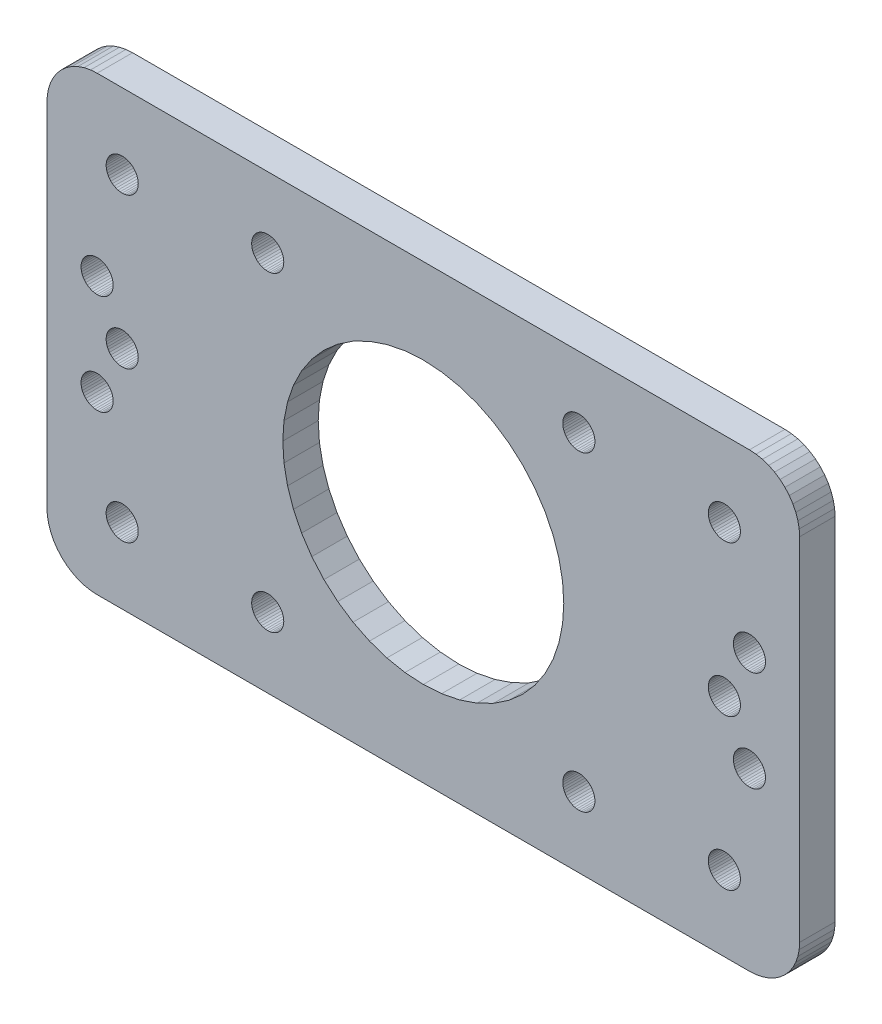
from build123d import *

# Parameters (mm, degrees)
BOSS_EXTRUDE1_DEPTH = 3.532000065


with BuildPart() as part:
    # Sketch1 → Boss-Extrude1 (new body)
    with BuildSketch(Plane.XY.offset(3.532000065)):
        Polygon((70, 0), (70.652633667, 0.042775694), (71.2940979, 0.170370862), (71.913414001, 0.38060233), (72.5, 0.669872999), (73.043807983, 1.033233285), (73.53553772, 1.464466095), (73.966766357, 1.956192851), (74.330123901, 2.5), (74.619400024, 3.086582899), (74.829627991, 3.705904722), (74.957221985, 4.347369194), (75, 5), (75, 40), (74.957221985, 40.652629852), (74.829627991, 41.294094086), (74.619400024, 41.913417816), (74.330123901, 42.5), (73.966766357, 43.043807983), (73.53553772, 43.535533905), (73.043807983, 43.966766357), (72.5, 44.330127716), (71.913414001, 44.61939621), (71.2940979, 44.829627991), (70.652633667, 44.9572258), (70, 45), (5, 45), (4.347369194, 44.9572258), (3.705904722, 44.829627991), (3.086582899, 44.61939621), (2.5, 44.330127716), (1.956192851, 43.966766357), (1.464466095, 43.535533905), (1.033233285, 43.043807983), (0.669872999, 42.5), (0.38060233, 41.913417816), (0.170370862, 41.294094086), (0.042775694, 40.652629852), (0, 40), (0, 5), (0.042775694, 4.347369194), (0.170370862, 3.705904722), (0.38060233, 3.086582899), (0.669872999, 2.5), (1.033233285, 1.956192851), (1.464466095, 1.464466095), (1.956192851, 1.033233285), (2.5, 0.669872999), (3.086582899, 0.38060233), (3.705904722, 0.170370862), (4.347369194, 0.042775694), (5, 0), align=None)
        Polygon((5.954518795, 22.085889816), (5.913688183, 22.291158676), (5.900000095, 22.5), (5.913688183, 22.708841324), (5.954518795, 22.914110184), (6.021792889, 23.112293243), (6.114359379, 23.299999237), (6.230634689, 23.474018097), (6.368628979, 23.631370544), (6.525981903, 23.769365311), (6.699999809, 23.885641098), (6.88770628, 23.978206635), (7.085889339, 24.045480728), (7.291158199, 24.08631134), (7.5, 24.100000381), (7.708841801, 24.08631134), (7.914110661, 24.045480728), (8.112293243, 23.978206635), (8.300000191, 23.885641098), (8.474018097, 23.769365311), (8.631370544, 23.631370544), (8.769365311, 23.474018097), (8.885641098, 23.299999237), (8.978207588, 23.112293243), (9.045481682, 22.914110184), (9.08631134, 22.708841324), (9.100000381, 22.5), (9.08631134, 22.291158676), (9.045481682, 22.085889816), (8.978207588, 21.887706757), (8.885641098, 21.700000763), (8.769365311, 21.525981903), (8.631370544, 21.368629456), (8.474018097, 21.230634689), (8.300000191, 21.114358902), (8.112293243, 21.021793365), (7.914110661, 20.954519272), (7.708841801, 20.91368866), (7.5, 20.899999619), (7.291158199, 20.91368866), (7.085889339, 20.954519272), (6.88770628, 21.021793365), (6.699999809, 21.114358902), (6.525981903, 21.230634689), (6.368628979, 21.368629456), (6.230634689, 21.525981903), (6.114359379, 21.700000763), (6.021792889, 21.887706757), align=None, mode=Mode.SUBTRACT)
        Polygon((5.61229372, 18.978206635), (5.800000191, 18.885641098), (5.974018097, 18.769365311), (6.131371021, 18.631370544), (6.269365311, 18.474018097), (6.385640621, 18.299999237), (6.478207111, 18.112293243), (6.545481205, 17.914110184), (6.586311817, 17.708841324), (6.599999905, 17.5), (6.586311817, 17.291158676), (6.545481205, 17.085889816), (6.478207111, 16.887706757), (6.385640621, 16.700000763), (6.269365311, 16.525981903), (6.131371021, 16.368629456), (5.974018097, 16.230634689), (5.800000191, 16.114358902), (5.61229372, 16.021793365), (5.414110661, 15.954518318), (5.208841801, 15.91368866), (5, 15.899999619), (4.791158199, 15.91368866), (4.585889339, 15.954518318), (4.38770628, 16.021793365), (4.199999809, 16.114358902), (4.025981903, 16.230634689), (3.868629217, 16.368629456), (3.730634689, 16.525981903), (3.614359379, 16.700000763), (3.52179265, 16.887706757), (3.454518795, 17.085889816), (3.413688183, 17.291158676), (3.400000095, 17.5), (3.413688183, 17.708841324), (3.454518795, 17.914110184), (3.52179265, 18.112293243), (3.614359379, 18.299999237), (3.730634689, 18.474018097), (3.868629217, 18.631370544), (4.025981903, 18.769365311), (4.199999809, 18.885641098), (4.38770628, 18.978206635), (4.585889339, 19.045480728), (4.791158199, 19.08631134), (5, 19.100000381), (5.208841801, 19.08631134), (5.414110661, 19.045480728), align=None, mode=Mode.SUBTRACT)
        Polygon((69.387702942, 18.978206635), (69.585891724, 19.045480728), (69.791160583, 19.08631134), (70, 19.100000381), (70.208839417, 19.08631134), (70.414108276, 19.045480728), (70.612297058, 18.978206635), (70.800003052, 18.885641098), (70.974021912, 18.769365311), (71.131370544, 18.631370544), (71.269363403, 18.474018097), (71.385643005, 18.299999237), (71.478210449, 18.112293243), (71.545478821, 17.914110184), (71.58631134, 17.708841324), (71.599998474, 17.5), (71.58631134, 17.291158676), (71.545478821, 17.085889816), (71.478210449, 16.887706757), (71.385643005, 16.700000763), (71.269363403, 16.525981903), (71.131370544, 16.368629456), (70.974021912, 16.230634689), (70.800003052, 16.114358902), (70.612297058, 16.021793365), (70.414108276, 15.954518318), (70.208839417, 15.91368866), (70, 15.899999619), (69.791160583, 15.91368866), (69.585891724, 15.954518318), (69.387702942, 16.021793365), (69.199996948, 16.114358902), (69.025978088, 16.230634689), (68.868629456, 16.368629456), (68.730636597, 16.525981903), (68.614356995, 16.700000763), (68.521789551, 16.887706757), (68.454521179, 17.085889816), (68.41368866, 17.291158676), (68.400001526, 17.5), (68.41368866, 17.708841324), (68.454521179, 17.914110184), (68.521789551, 18.112293243), (68.614356995, 18.299999237), (68.730636597, 18.474018097), (68.868629456, 18.631370544), (69.025978088, 18.769365311), (69.199996948, 18.885641098), align=None, mode=Mode.SUBTRACT)
        Polygon((69.08631134, 22.708841324), (69.099998474, 22.5), (69.08631134, 22.291158676), (69.045478821, 22.085889816), (68.978210449, 21.887706757), (68.885643005, 21.700000763), (68.769363403, 21.525981903), (68.631370544, 21.368629456), (68.474021912, 21.230634689), (68.300003052, 21.114358902), (68.112297058, 21.021793365), (67.914108276, 20.954519272), (67.708839417, 20.91368866), (67.5, 20.899999619), (67.291160583, 20.91368866), (67.085891724, 20.954519272), (66.887702942, 21.021793365), (66.699996948, 21.114358902), (66.525978088, 21.230634689), (66.368629456, 21.368629456), (66.230636597, 21.525981903), (66.114356995, 21.700000763), (66.021789551, 21.887706757), (65.954521179, 22.085889816), (65.91368866, 22.291158676), (65.900001526, 22.5), (65.91368866, 22.708841324), (65.954521179, 22.914110184), (66.021789551, 23.112293243), (66.114356995, 23.299999237), (66.230636597, 23.474018097), (66.368629456, 23.631370544), (66.525978088, 23.769365311), (66.699996948, 23.885641098), (66.887702942, 23.978206635), (67.085891724, 24.045480728), (67.291160583, 24.08631134), (67.5, 24.100000381), (67.708839417, 24.08631134), (67.914108276, 24.045480728), (68.112297058, 23.978206635), (68.300003052, 23.885641098), (68.474021912, 23.769365311), (68.631370544, 23.631370544), (68.769363403, 23.474018097), (68.885643005, 23.299999237), (68.978210449, 23.112293243), (69.045478821, 22.914110184), align=None, mode=Mode.SUBTRACT)
        Polygon((6.368628979, 8.631370544), (6.525981903, 8.769365311), (6.699999809, 8.885641098), (6.88770628, 8.978207588), (7.085889339, 9.045481682), (7.291158199, 9.08631134), (7.5, 9.100000381), (7.708841801, 9.08631134), (7.914110661, 9.045481682), (8.112293243, 8.978207588), (8.300000191, 8.885641098), (8.474018097, 8.769365311), (8.631370544, 8.631370544), (8.769365311, 8.474018097), (8.885641098, 8.300000191), (8.978207588, 8.112293243), (9.045481682, 7.914110661), (9.08631134, 7.708841801), (9.100000381, 7.5), (9.08631134, 7.291158199), (9.045481682, 7.085889339), (8.978207588, 6.88770628), (8.885641098, 6.699999809), (8.769365311, 6.525981903), (8.631370544, 6.368628979), (8.474018097, 6.230634689), (8.300000191, 6.114359379), (8.112293243, 6.021792889), (7.914110661, 5.954518795), (7.708841801, 5.913688183), (7.5, 5.900000095), (7.291158199, 5.913688183), (7.085889339, 5.954518795), (6.88770628, 6.021792889), (6.699999809, 6.114359379), (6.525981903, 6.230634689), (6.368628979, 6.368628979), (6.230634689, 6.525981903), (6.114359379, 6.699999809), (6.021792889, 6.88770628), (5.954518795, 7.085889339), (5.913688183, 7.291158199), (5.900000095, 7.5), (5.913688183, 7.708841801), (5.954518795, 7.914110661), (6.021792889, 8.112293243), (6.114359379, 8.300000191), (6.230634689, 8.474018097), align=None, mode=Mode.SUBTRACT)
        Polygon((68.300003052, 8.885641098), (68.474021912, 8.769365311), (68.631370544, 8.631370544), (68.769363403, 8.474018097), (68.885643005, 8.300000191), (68.978210449, 8.112293243), (69.045478821, 7.914110661), (69.08631134, 7.708841801), (69.099998474, 7.5), (69.08631134, 7.291158199), (69.045478821, 7.085889339), (68.978210449, 6.88770628), (68.885643005, 6.699999809), (68.769363403, 6.525981903), (68.631370544, 6.368628979), (68.474021912, 6.230634689), (68.300003052, 6.114359379), (68.112297058, 6.021792889), (67.914108276, 5.954518795), (67.708839417, 5.913688183), (67.5, 5.900000095), (67.291160583, 5.913688183), (67.085891724, 5.954518795), (66.887702942, 6.021792889), (66.699996948, 6.114359379), (66.525978088, 6.230634689), (66.368629456, 6.368628979), (66.230636597, 6.525981903), (66.114356995, 6.699999809), (66.021789551, 6.88770628), (65.954521179, 7.085889339), (65.91368866, 7.291158199), (65.900001526, 7.5), (65.91368866, 7.708841801), (65.954521179, 7.914110661), (66.021789551, 8.112293243), (66.114356995, 8.300000191), (66.230636597, 8.474018097), (66.368629456, 8.631370544), (66.525978088, 8.769365311), (66.699996948, 8.885641098), (66.887702942, 8.978207588), (67.085891724, 9.045481682), (67.291160583, 9.08631134), (67.5, 9.100000381), (67.708839417, 9.08631134), (67.914108276, 9.045481682), (68.112297058, 8.978207588), align=None, mode=Mode.SUBTRACT)
        Polygon((6.586311817, 27.708841324), (6.599999905, 27.5), (6.586311817, 27.291158676), (6.545481205, 27.085889816), (6.478207111, 26.887706757), (6.385640621, 26.700000763), (6.269365311, 26.525981903), (6.131371021, 26.368629456), (5.974018097, 26.230634689), (5.800000191, 26.114358902), (5.61229372, 26.021793365), (5.414110661, 25.954519272), (5.208841801, 25.91368866), (5, 25.899999619), (4.791158199, 25.91368866), (4.585889339, 25.954519272), (4.38770628, 26.021793365), (4.199999809, 26.114358902), (4.025981903, 26.230634689), (3.868629217, 26.368629456), (3.730634689, 26.525981903), (3.614359379, 26.700000763), (3.52179265, 26.887706757), (3.454518795, 27.085889816), (3.413688183, 27.291158676), (3.400000095, 27.5), (3.413688183, 27.708841324), (3.454518795, 27.914110184), (3.52179265, 28.112293243), (3.614359379, 28.299999237), (3.730634689, 28.474018097), (3.868629217, 28.631370544), (4.025981903, 28.769365311), (4.199999809, 28.885641098), (4.38770628, 28.978206635), (4.585889339, 29.045480728), (4.791158199, 29.08631134), (5, 29.100000381), (5.208841801, 29.08631134), (5.414110661, 29.045480728), (5.61229372, 28.978206635), (5.800000191, 28.885641098), (5.974018097, 28.769365311), (6.131371021, 28.631370544), (6.269365311, 28.474018097), (6.385640621, 28.299999237), (6.478207111, 28.112293243), (6.545481205, 27.914110184), align=None, mode=Mode.SUBTRACT)
        Polygon((68.300003052, 36.114360809), (68.112297058, 36.021793365), (67.914108276, 35.954517365), (67.708839417, 35.91368866), (67.5, 35.900001526), (67.291160583, 35.91368866), (67.085891724, 35.954517365), (66.887702942, 36.021793365), (66.699996948, 36.114360809), (66.525978088, 36.230632782), (66.368629456, 36.368629456), (66.230636597, 36.525981903), (66.114356995, 36.700000763), (66.021789551, 36.887706757), (65.954521179, 37.085887909), (65.91368866, 37.291156769), (65.900001526, 37.5), (65.91368866, 37.708843231), (65.954521179, 37.914112091), (66.021789551, 38.112293243), (66.114356995, 38.299999237), (66.230636597, 38.474018097), (66.368629456, 38.631370544), (66.525978088, 38.769367218), (66.699996948, 38.885639191), (66.887702942, 38.978206635), (67.085891724, 39.045482635), (67.291160583, 39.08631134), (67.5, 39.099998474), (67.708839417, 39.08631134), (67.914108276, 39.045482635), (68.112297058, 38.978206635), (68.300003052, 38.885639191), (68.474021912, 38.769367218), (68.631370544, 38.631370544), (68.769363403, 38.474018097), (68.885643005, 38.299999237), (68.978210449, 38.112293243), (69.045478821, 37.914112091), (69.08631134, 37.708843231), (69.099998474, 37.5), (69.08631134, 37.291156769), (69.045478821, 37.085887909), (68.978210449, 36.887706757), (68.885643005, 36.700000763), (68.769363403, 36.525981903), (68.631370544, 36.368629456), (68.474021912, 36.230632782), align=None, mode=Mode.SUBTRACT)
        Polygon((6.88770628, 36.021793365), (6.699999809, 36.114360809), (6.525981903, 36.230632782), (6.368628979, 36.368629456), (6.230634689, 36.525981903), (6.114359379, 36.700000763), (6.021792889, 36.887706757), (5.954518795, 37.085887909), (5.913688183, 37.291156769), (5.900000095, 37.5), (5.913688183, 37.708843231), (5.954518795, 37.914112091), (6.021792889, 38.112293243), (6.114359379, 38.299999237), (6.230634689, 38.474018097), (6.368628979, 38.631370544), (6.525981903, 38.769367218), (6.699999809, 38.885639191), (6.88770628, 38.978206635), (7.085889339, 39.045482635), (7.291158199, 39.08631134), (7.5, 39.099998474), (7.708841801, 39.08631134), (7.914110661, 39.045482635), (8.112293243, 38.978206635), (8.300000191, 38.885639191), (8.474018097, 38.769367218), (8.631370544, 38.631370544), (8.769365311, 38.474018097), (8.885641098, 38.299999237), (8.978207588, 38.112293243), (9.045481682, 37.914112091), (9.08631134, 37.708843231), (9.100000381, 37.5), (9.08631134, 37.291156769), (9.045481682, 37.085887909), (8.978207588, 36.887706757), (8.885641098, 36.700000763), (8.769365311, 36.525981903), (8.631370544, 36.368629456), (8.474018097, 36.230632782), (8.300000191, 36.114360809), (8.112293243, 36.021793365), (7.914110661, 35.954517365), (7.708841801, 35.91368866), (7.5, 35.900001526), (7.291158199, 35.91368866), (7.085889339, 35.954517365), align=None, mode=Mode.SUBTRACT)
        Polygon((20.730634689, 7.974018097), (20.868629456, 8.131370544), (21.025981903, 8.269365311), (21.200000763, 8.385641098), (21.387706757, 8.478207588), (21.585889816, 8.545481682), (21.791158676, 8.58631134), (22, 8.600000381), (22.208841324, 8.58631134), (22.414110184, 8.545481682), (22.612293243, 8.478207588), (22.799999237, 8.385641098), (22.974018097, 8.269365311), (23.131370544, 8.131370544), (23.269365311, 7.974018097), (23.385641098, 7.800000191), (23.478206635, 7.61229372), (23.545480728, 7.414110661), (23.58631134, 7.208841801), (23.600000381, 7), (23.58631134, 6.791158199), (23.545480728, 6.585889339), (23.478206635, 6.38770628), (23.385641098, 6.199999809), (23.269365311, 6.025981903), (23.131370544, 5.868628979), (22.974018097, 5.730634689), (22.799999237, 5.614359379), (22.612293243, 5.521792889), (22.414110184, 5.454518795), (22.208841324, 5.413688183), (22, 5.400000095), (21.791158676, 5.413688183), (21.585889816, 5.454518795), (21.387706757, 5.521792889), (21.200000763, 5.614359379), (21.025981903, 5.730634689), (20.868629456, 5.868628979), (20.730634689, 6.025981903), (20.614358902, 6.199999809), (20.521793365, 6.38770628), (20.454519272, 6.585889339), (20.41368866, 6.791158199), (20.399999619, 7), (20.41368866, 7.208841801), (20.454519272, 7.414110661), (20.521793365, 7.61229372), (20.614358902, 7.800000191), align=None, mode=Mode.SUBTRACT)
        Polygon((21.025981903, 36.730632782), (20.868629456, 36.868629456), (20.730634689, 37.025981903), (20.614358902, 37.200000763), (20.521793365, 37.387706757), (20.454519272, 37.585887909), (20.41368866, 37.791156769), (20.399999619, 38), (20.41368866, 38.208843231), (20.454519272, 38.414112091), (20.521793365, 38.612293243), (20.614358902, 38.799999237), (20.730634689, 38.974018097), (20.868629456, 39.131370544), (21.025981903, 39.269367218), (21.200000763, 39.385639191), (21.387706757, 39.478206635), (21.585889816, 39.545482635), (21.791158676, 39.58631134), (22, 39.599998474), (22.208841324, 39.58631134), (22.414110184, 39.545482635), (22.612293243, 39.478206635), (22.799999237, 39.385639191), (22.974018097, 39.269367218), (23.131370544, 39.131370544), (23.269365311, 38.974018097), (23.385641098, 38.799999237), (23.478206635, 38.612293243), (23.545480728, 38.414112091), (23.58631134, 38.208843231), (23.600000381, 38), (23.58631134, 37.791156769), (23.545480728, 37.585887909), (23.478206635, 37.387706757), (23.385641098, 37.200000763), (23.269365311, 37.025981903), (23.131370544, 36.868629456), (22.974018097, 36.730632782), (22.799999237, 36.614360809), (22.612293243, 36.521793365), (22.414110184, 36.454517365), (22.208841324, 36.41368866), (22, 36.400001526), (21.791158676, 36.41368866), (21.585889816, 36.454517365), (21.387706757, 36.521793365), (21.200000763, 36.614360809), align=None, mode=Mode.SUBTRACT)
        Polygon((53.612293243, 8.478207588), (53.799999237, 8.385641098), (53.974018097, 8.269365311), (54.131370544, 8.131370544), (54.269367218, 7.974018097), (54.385639191, 7.800000191), (54.478206635, 7.61229372), (54.545482635, 7.414110661), (54.58631134, 7.208841801), (54.599998474, 7), (54.58631134, 6.791158199), (54.545482635, 6.585889339), (54.478206635, 6.38770628), (54.385639191, 6.199999809), (54.269367218, 6.025981903), (54.131370544, 5.868628979), (53.974018097, 5.730634689), (53.799999237, 5.614359379), (53.612293243, 5.521792889), (53.414112091, 5.454518795), (53.208843231, 5.413688183), (53, 5.400000095), (52.791156769, 5.413688183), (52.585887909, 5.454518795), (52.387706757, 5.521792889), (52.200000763, 5.614359379), (52.025981903, 5.730634689), (51.868629456, 5.868628979), (51.730632782, 6.025981903), (51.614360809, 6.199999809), (51.521793365, 6.38770628), (51.454517365, 6.585889339), (51.41368866, 6.791158199), (51.400001526, 7), (51.41368866, 7.208841801), (51.454517365, 7.414110661), (51.521793365, 7.61229372), (51.614360809, 7.800000191), (51.730632782, 7.974018097), (51.868629456, 8.131370544), (52.025981903, 8.269365311), (52.200000763, 8.385641098), (52.387706757, 8.478207588), (52.585887909, 8.545481682), (52.791156769, 8.58631134), (53, 8.600000381), (53.208843231, 8.58631134), (53.414112091, 8.545481682), align=None, mode=Mode.SUBTRACT)
        Polygon((69.791160583, 25.91368866), (69.585891724, 25.954519272), (69.387702942, 26.021793365), (69.199996948, 26.114358902), (69.025978088, 26.230634689), (68.868629456, 26.368629456), (68.730636597, 26.525981903), (68.614356995, 26.700000763), (68.521789551, 26.887706757), (68.454521179, 27.085889816), (68.41368866, 27.291158676), (68.400001526, 27.5), (68.41368866, 27.708841324), (68.454521179, 27.914110184), (68.521789551, 28.112293243), (68.614356995, 28.299999237), (68.730636597, 28.474018097), (68.868629456, 28.631370544), (69.025978088, 28.769365311), (69.199996948, 28.885641098), (69.387702942, 28.978206635), (69.585891724, 29.045480728), (69.791160583, 29.08631134), (70, 29.100000381), (70.208839417, 29.08631134), (70.414108276, 29.045480728), (70.612297058, 28.978206635), (70.800003052, 28.885641098), (70.974021912, 28.769365311), (71.131370544, 28.631370544), (71.269363403, 28.474018097), (71.385643005, 28.299999237), (71.478210449, 28.112293243), (71.545478821, 27.914110184), (71.58631134, 27.708841324), (71.599998474, 27.5), (71.58631134, 27.291158676), (71.545478821, 27.085889816), (71.478210449, 26.887706757), (71.385643005, 26.700000763), (71.269363403, 26.525981903), (71.131370544, 26.368629456), (70.974021912, 26.230634689), (70.800003052, 26.114358902), (70.612297058, 26.021793365), (70.414108276, 25.954519272), (70.208839417, 25.91368866), (70, 25.899999619), align=None, mode=Mode.SUBTRACT)
        Polygon((42.857566833, 9.565686226), (41.123466492, 8.977038383), (39.327365875, 8.619771957), (37.5, 8.5), (35.672634125, 8.619771957), (33.876533508, 8.977038383), (32.142433167, 9.565686226), (30.5, 10.375644684), (28.977340698, 11.393053055), (27.600505829, 12.600504875), (26.393053055, 13.977339745), (25.375644684, 15.5), (24.56568718, 17.142431259), (23.977039337, 18.876533508), (23.619771957, 20.672634125), (23.5, 22.5), (23.619771957, 24.327365875), (23.977039337, 26.123466492), (24.56568718, 27.857568741), (25.375644684, 29.5), (26.393053055, 31.022659302), (27.600505829, 32.399494171), (28.977340698, 33.606945038), (30.5, 34.624355316), (32.142433167, 35.434314728), (33.876533508, 36.022960663), (35.672634125, 36.38022995), (37.5, 36.5), (39.327365875, 36.38022995), (41.123466492, 36.022960663), (42.857566833, 35.434314728), (44.5, 34.624355316), (46.022659302, 33.606945038), (47.399494171, 32.399494171), (48.606945038, 31.022659302), (49.624355316, 29.5), (50.434314728, 27.857568741), (51.022960663, 26.123466492), (51.38022995, 24.327365875), (51.5, 22.5), (51.38022995, 20.672634125), (51.022960663, 18.876533508), (50.434314728, 17.142431259), (49.624355316, 15.5), (48.606945038, 13.977339745), (47.399494171, 12.600504875), (46.022659302, 11.393053055), (44.5, 10.375644684), align=None, mode=Mode.SUBTRACT)
        Polygon((51.614360809, 38.799999237), (51.730632782, 38.974018097), (51.868629456, 39.131370544), (52.025981903, 39.269367218), (52.200000763, 39.385639191), (52.387706757, 39.478206635), (52.585887909, 39.545482635), (52.791156769, 39.58631134), (53, 39.599998474), (53.208843231, 39.58631134), (53.414112091, 39.545482635), (53.612293243, 39.478206635), (53.799999237, 39.385639191), (53.974018097, 39.269367218), (54.131370544, 39.131370544), (54.269367218, 38.974018097), (54.385639191, 38.799999237), (54.478206635, 38.612293243), (54.545482635, 38.414112091), (54.58631134, 38.208843231), (54.599998474, 38), (54.58631134, 37.791156769), (54.545482635, 37.585887909), (54.478206635, 37.387706757), (54.385639191, 37.200000763), (54.269367218, 37.025981903), (54.131370544, 36.868629456), (53.974018097, 36.730632782), (53.799999237, 36.614360809), (53.612293243, 36.521793365), (53.414112091, 36.454517365), (53.208843231, 36.41368866), (53, 36.400001526), (52.791156769, 36.41368866), (52.585887909, 36.454517365), (52.387706757, 36.521793365), (52.200000763, 36.614360809), (52.025981903, 36.730632782), (51.868629456, 36.868629456), (51.730632782, 37.025981903), (51.614360809, 37.200000763), (51.521793365, 37.387706757), (51.454517365, 37.585887909), (51.41368866, 37.791156769), (51.400001526, 38), (51.41368866, 38.208843231), (51.454517365, 38.414112091), (51.521793365, 38.612293243), align=None, mode=Mode.SUBTRACT)
    extrude(amount=-BOSS_EXTRUDE1_DEPTH)


solid = part.part
